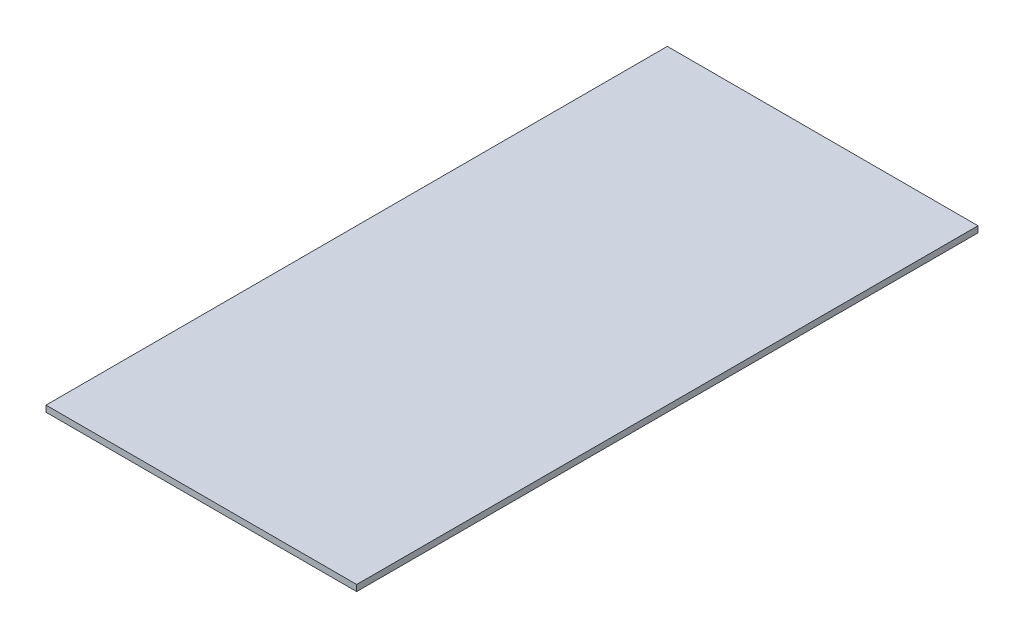
from build123d import *

# Parameters (mm, degrees)
SKETCH1_W           = 914.4
SKETCH1_H           = 1828.8
BOSS_EXTRUDE1_DEPTH = 18.25625


with BuildPart() as part:
    # Sketch1 → Boss-Extrude1 (new body)
    with BuildSketch(Plane(origin=(0, 0, 0), x_dir=(1, 0, 0), z_dir=(0, 1, 0))):
        Rectangle(SKETCH1_W, SKETCH1_H)
    extrude(amount=BOSS_EXTRUDE1_DEPTH)


solid = part.part
